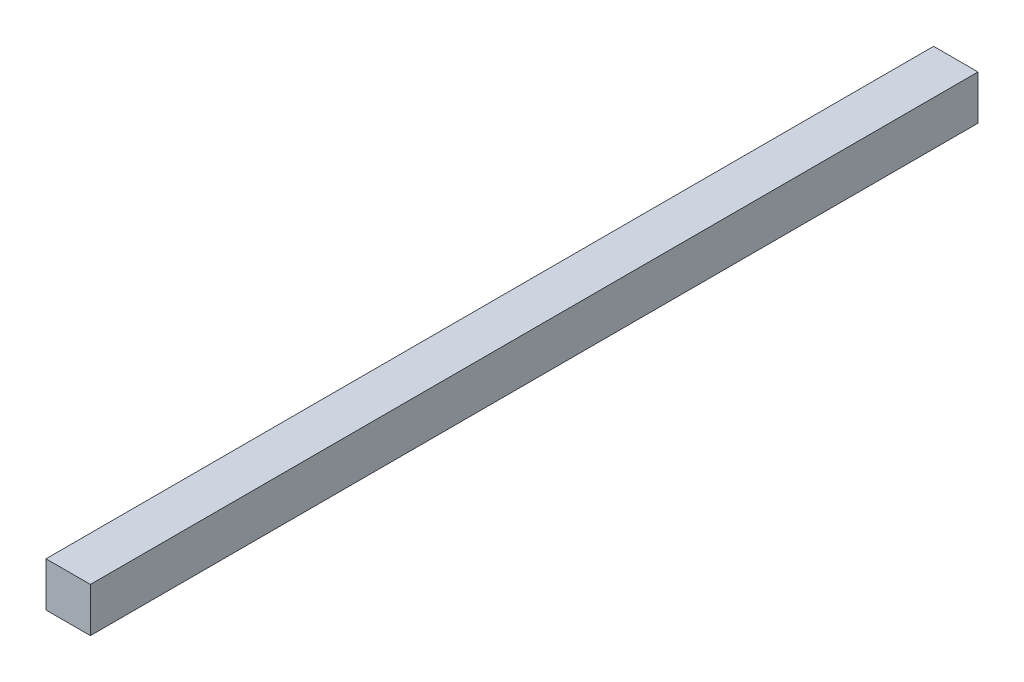
from build123d import *

# Parameters (mm, degrees)
SKETCH1_W           = 230
SKETCH1_H           = 230
BOSS_EXTRUDE1_DEPTH = 4600
SHELL1_T            = -20
BOSS_EXTRUDE2_REACH = 4613.486
SKETCH2_R           = 25


with BuildPart() as part:
    # Sketch1 → Boss-Extrude1 (new body)
    with BuildSketch(Plane.XY):
        with Locations((0, 115)):
            Rectangle(SKETCH1_W, SKETCH1_H)
    extrude(amount=BOSS_EXTRUDE1_DEPTH)

    # Shell1
    shell1_openings = [part.faces().sort_by_distance(p)[0] for p in [
        (0, 115, 0),
    ]]
    offset(amount=SHELL1_T, openings=shell1_openings, kind=Kind.INTERSECTION)

    # Sketch2 → Boss-Extrude2 (add, up to next)
    with BuildSketch(Plane(origin=(115, 0, 0), x_dir=(0, 0, -1), z_dir=(1, 0, 0)), mode=Mode.PRIVATE) as boss_extrude2_sk1:
        with Locations(Location((-4050, 115, 0), (0, 0, 90))):
            Circle(SKETCH2_R)
    boss_extrude2_tool1 = extrude(boss_extrude2_sk1.sketch, amount=-BOSS_EXTRUDE2_REACH, mode=Mode.PRIVATE) - part.part
    add(boss_extrude2_tool1.solids().sort_by_distance((115, 115, 4050))[0])


solid = part.part
